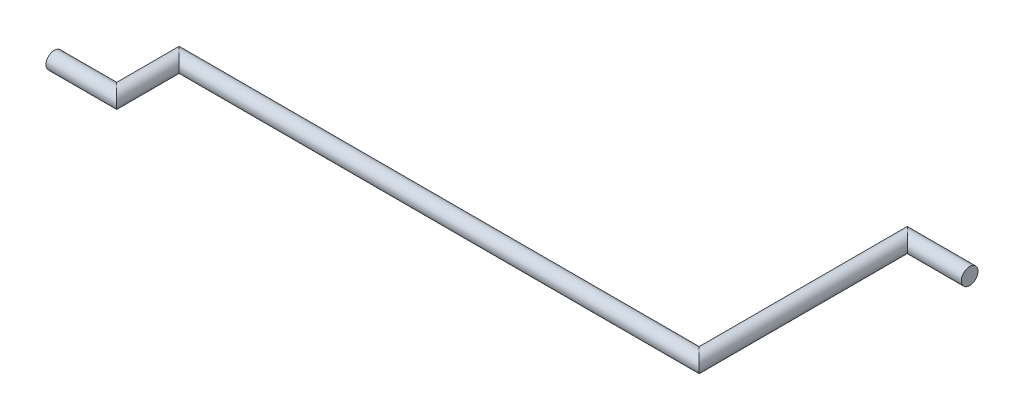
from build123d import *

# Parameters (mm, degrees)
SKETCH2_R = 0.4


with BuildPart() as part:
    # Sweep1: sweep along a path in Sketch1
    with BuildLine(Plane(origin=(0, 0, 0), x_dir=(1, 0, 0), z_dir=(0, 1, 0))) as sweep1_path:
        Line((0, 0), (3, 0))
        Line((3, 0), (3, 3))
        Line((3, 3), (28, 3))
        Line((28, 3), (28, 13))
        Line((28, 13), (31, 13))
    # Sketch2 → Sweep1 (sweep)
    with BuildSketch(Plane(origin=(0, 0, 0), x_dir=(0, 0, -1), z_dir=(1, 0, 0))):
        Circle(SKETCH2_R)
    sweep(path=sweep1_path.line, transition=Transition.RIGHT)


solid = part.part
